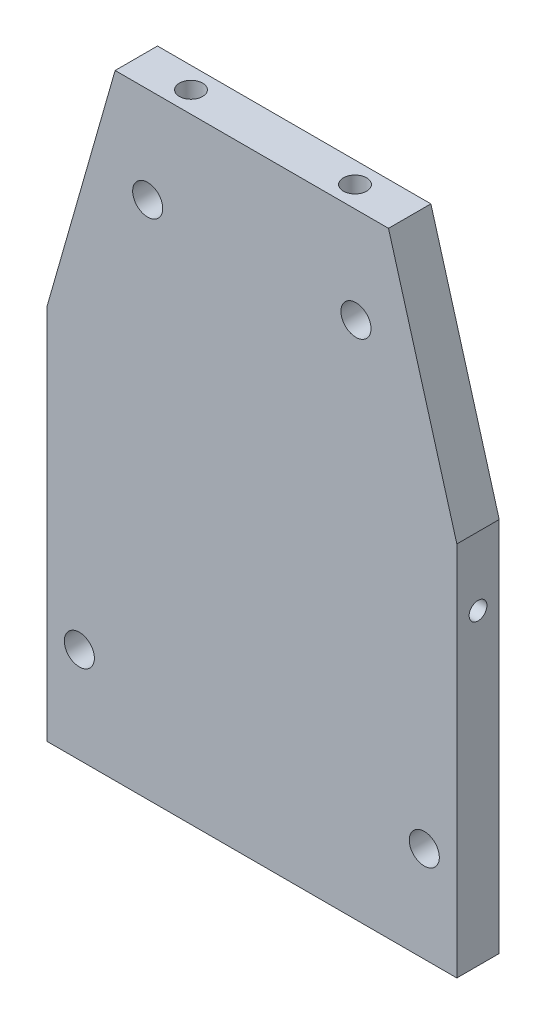
from build123d import *

# Parameters (mm, degrees)
EXTRUDE_1_4_DEPTH = 3.1
SKETCH4_R         = 1.7
M4_DRILL_DEPTH    = 8
SKETCH5_R         = 1.7
M4_DRILL2_DEPTH   = 8
SKETCH6_R         = 2.2
M4_THROUGH_DEPTH  = 6.2
SKETCH7_R         = 1.3
M3_DRILL_DEPTH    = 10


with BuildPart() as part:
    # Sketch1 → 1/4 (new, symmetric)
    with BuildSketch(Plane.XY):
        Polygon((-20, 45), (20, 45), (30, 10), (30, -45), (-30, -45), (-30, 10), align=None)
    extrude(amount=EXTRUDE_1_4_DEPTH, both=True)

    # Sketch4 → M4_DRILL (cut)
    with BuildSketch(Plane(origin=(0, 45, 0), x_dir=(1, 0, 0), z_dir=(0, 1, 0))):
        with Locations(Location((-12, 0, 0), (0, 0, 180))):
            Circle(SKETCH4_R)
        with Locations((12, 0)):
            Circle(SKETCH4_R)
    extrude(amount=-M4_DRILL_DEPTH, mode=Mode.SUBTRACT)

    # Sketch5 → M4_DRILL2 (cut)
    with BuildSketch(Plane(origin=(0, -45, 0), x_dir=(-1, 0, 0), z_dir=(0, -1, 0))):
        with Locations(Location((-20, 0, 0), (0, 0, 180))):
            Circle(SKETCH5_R)
        with Locations((20, 0)):
            Circle(SKETCH5_R)
        with Locations(Location((0, 0, 0), (0, 0, 180))):
            Circle(SKETCH5_R)
    extrude(amount=-M4_DRILL2_DEPTH, mode=Mode.SUBTRACT)

    # Sketch6 → M4_through (cut)
    with BuildSketch(Plane.XY.offset(3.1)):
        with Locations((-25.2375, -31)):
            Circle(SKETCH6_R)
        with Locations((25.2375, -31)):
            Circle(SKETCH6_R)
        with Locations((-15.2375, 31)):
            Circle(SKETCH6_R)
        with Locations((15.2375, 31)):
            Circle(SKETCH6_R)
    extrude(amount=-M4_THROUGH_DEPTH, mode=Mode.SUBTRACT)

    # Sketch7 → M3_Drill (cut)
    with BuildSketch(Plane.ZY.offset(30)):
        with Locations(Location((0, 0, 0), (0, 0, 270))):
            Circle(SKETCH7_R)
    m3_drill = extrude(amount=-M3_DRILL_DEPTH, mode=Mode.SUBTRACT)

    # Mirror1: M3_Drill across plane
    add(m3_drill.mirror(Plane(origin=(0, 0, 0), x_dir=(0, 0, 1), z_dir=(1, 0, 0))), mode=Mode.SUBTRACT)


solid = part.part
